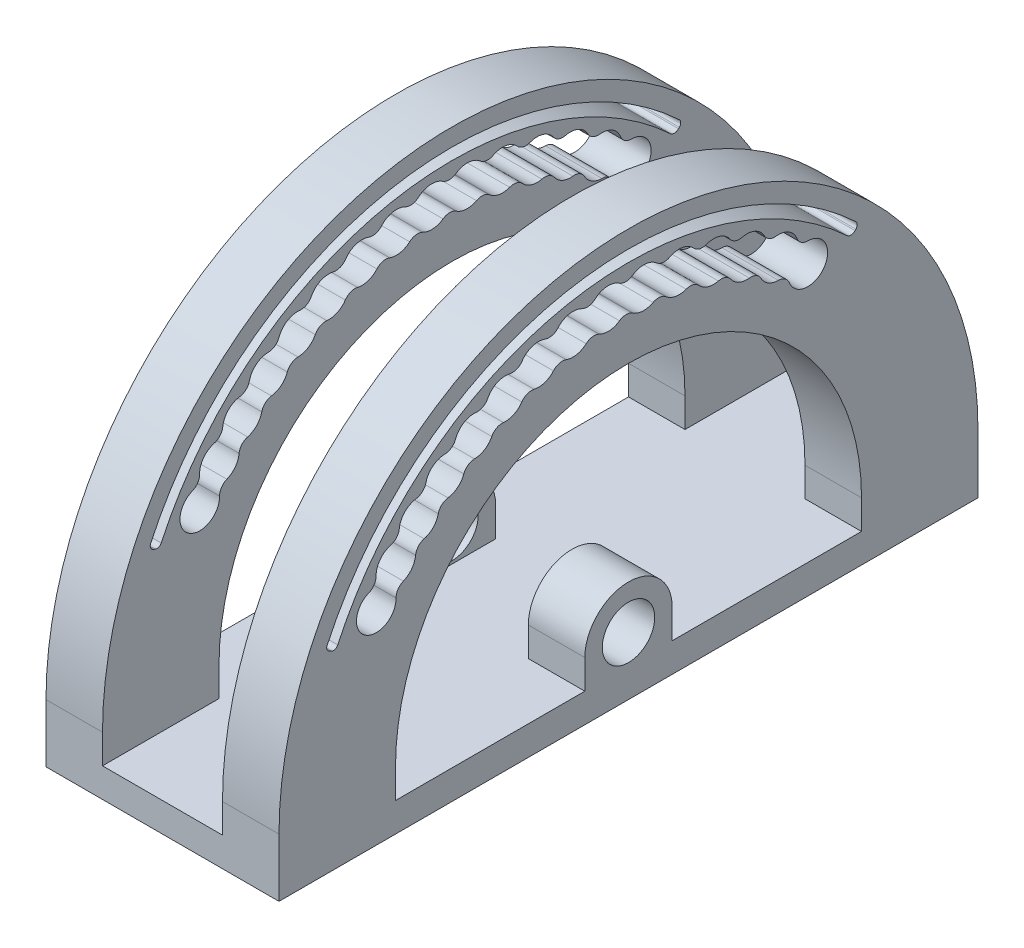
from build123d import *

# Parameters (mm, degrees)
SKETCH_1_W          = 40
SKETCH_1_H          = 120
EXTRUDE_1_DEPTH     = 5
SKETCH_2_R          = 4.5
EXTRUDE_5_DEPTH     = 9.7
EXTRUDE_6_DEPTH     = 9.7
CUT_EXTRUDE_1_DEPTH = 9.7
CUT_EXTRUDE_2_DEPTH = 9.7


with BuildPart() as part:
    # 草图1 → 凸台-拉伸1 (new body)
    with BuildSketch(Plane(origin=(0, 0, 0), x_dir=(1, 0, 0), z_dir=(0, 1, 0))):
        Rectangle(SKETCH_1_W, SKETCH_1_H)
    extrude(amount=EXTRUDE_1_DEPTH)

    # 草图2 → 凸台-拉伸5 (add)
    with BuildSketch(Plane(origin=(20, 0, 0), x_dir=(0, 0, -1), z_dir=(1, 0, 0))):
        with BuildLine():
            Line((-7.5, 5), (7.5, 5))
            Line((7.5, 5), (7.5, 10))
            ThreePointArc((7.5, 10), (0, 17.5), (-7.5, 10))
            Line((-7.5, 10), (-7.5, 5))
        make_face()
        with Locations((0, 10)):
            Circle(SKETCH_2_R, mode=Mode.SUBTRACT)
    extrude_5 = extrude(amount=-EXTRUDE_5_DEPTH)

    # 镜向1: 凸台-拉伸5 across plane
    add(extrude_5.mirror(Plane(origin=(0, 0, 0), x_dir=(0, 0, 1), z_dir=(1, 0, 0))))

    # 草图3 → 凸台-拉伸6 (add)
    with BuildSketch(Plane(origin=(20, 0, 0), x_dir=(0, 0, -1), z_dir=(1, 0, 0))):
        with BuildLine():
            Line((-60, 10), (-60, 5))
            Line((-60, 5), (-40, 5))
            Line((-40, 5), (-40, 10))
            ThreePointArc((-40, 10), (0, 50), (40, 10))
            Line((40, 10), (40, 5))
            Line((40, 5), (60, 5))
            Line((60, 5), (60, 10))
            ThreePointArc((60, 10), (0, 70), (-60, 10))
        make_face()
    extrude_6 = extrude(amount=-EXTRUDE_6_DEPTH)

    # 草图4 → 切除-拉伸1 (cut)
    with BuildSketch(Plane(origin=(20, 0, 0), x_dir=(0, 0, -1), z_dir=(1, 0, 0))):
        with BuildLine():
            ThreePointArc((-44.579297586, 38.150658022), (-45.177855939, 32.164788205), (-39.901709101, 35.054629743))
            ThreePointArc((-39.901709101, 35.054629743), (-39.569738929, 36.190638857), (-38.653748106, 36.940093135))
            ThreePointArc((-38.653748106, 36.940093135), (-37.216414768, 38.044580079), (-36.550896536, 39.730671422))
            ThreePointArc((-36.550896536, 39.730671422), (-36.082956134, 40.817755909), (-35.082457468, 41.449992668))
            ThreePointArc((-35.082457468, 41.449992668), (-33.521234696, 42.371080063), (-32.655194291, 43.963497267))
            ThreePointArc((-32.655194291, 43.963497267), (-32.058259573, 44.985451202), (-30.988168193, 45.491045248))
            ThreePointArc((-30.988168193, 45.491045248), (-29.326330223, 46.215001804), (-28.272678313, 47.690005596))
            ThreePointArc((-28.272678313, 47.690005596), (-27.555648201, 48.631593999), (-26.431916705, 49.00300809))
            ThreePointArc((-26.431916705, 49.00300809), (-24.694237713, 49.519041281), (-23.468681821, 50.854642752))
            ThreePointArc((-23.468681821, 50.854642752), (-22.642245583, 51.701828708), (-21.481626219, 51.933525916))
            ThreePointArc((-21.481626219, 51.933525916), (-19.694010997, 52.233942876), (-18.314821339, 53.410231284))
            ThreePointArc((-18.314821339, 53.410231284), (-17.391299234, 54.150385203), (-16.211094165, 54.238911455))
            ThreePointArc((-16.211094165, 54.238911455), (-14.400191938, 54.319233659), (-12.887929054, 55.318673254))
            ThreePointArc((-12.887929054, 55.318673254), (-11.881088671, 55.940761146), (-10.698892035, 55.88479672))
            ThreePointArc((-10.698892035, 55.88479672), (-8.891699185, 55.743826749), (-7.268907432, 56.551518187))
            ThreePointArc((-7.268907432, 56.551518187), (-6.193758441, 57.046266154), (-5.027194068, 56.84664535))
            ThreePointArc((-5.027194068, 56.84664535), (-3.250651676, 56.486484742), (-1.541523142, 57.090387206))
            ThreePointArc((-1.541523142, 57.090387206), (-0.414093539, 57.450419695), (0.719447784, 57.1101184))
            ThreePointArc((0.719447784, 57.1101184), (2.438855561, 56.53613632), (4.208841707, 56.927247013))
            ThreePointArc((4.208841707, 56.927247013), (5.371744544, 57.147196769), (6.455364326, 56.671288092))
            ThreePointArc((6.455364326, 56.671288092), (8.092005079, 55.89204129), (9.896462421, 56.064529655))
            ThreePointArc((9.896462421, 56.064529655), (11.077502288, 56.141117734), (12.095046255, 55.536696376))
            ThreePointArc((12.095046255, 55.536696376), (13.62452144, 54.563801628), (15.436549674, 54.515096259))
            ThreePointArc((15.436549674, 54.515096259), (16.618119988, 54.447180909), (17.554418903, 53.723257401))
            ThreePointArc((17.554418903, 53.723257401), (18.953927567, 52.571218326), (20.746513526, 52.302045309))
            ThreePointArc((20.746513526, 52.302045309), (21.910999795, 52.090638991), (22.752095597, 51.258005365))
            ThreePointArc((22.752095597, 51.258005365), (24.000774291, 49.943996213), (25.747194647, 49.458368296))
            ThreePointArc((25.747194647, 49.458368296), (26.877237063, 49.106622592), (27.610590951, 48.177691498))
            ThreePointArc((27.610590951, 48.177691498), (33.585102808, 47.474756475), (30.787782865, 52.800534419))
            ThreePointArc((30.787782865, 52.800534419), (29.657740449, 53.152280124), (28.924386561, 54.081211217))
            ThreePointArc((28.924386561, 54.081211217), (27.5030332, 55.772733857), (25.342222373, 56.233592609))
            ThreePointArc((25.342222373, 56.233592609), (24.177736104, 56.444998927), (23.336640302, 57.277632552))
            ThreePointArc((23.336640302, 57.277632552), (21.71973674, 58.783327438), (19.518867716, 58.977414421))
            ThreePointArc((19.518867716, 58.977414421), (18.337297402, 59.045329772), (17.400998487, 59.769253279))
            ThreePointArc((17.400998487, 59.769253279), (15.612649032, 61.066673968), (13.404531699, 60.991095794))
            ThreePointArc((13.404531699, 60.991095794), (12.223491831, 60.914507715), (11.205947864, 61.518929072))
            ThreePointArc((11.205947864, 61.518929072), (9.272812687, 62.588734011), (7.090364988, 62.244617375))
            ThreePointArc((7.090364988, 62.244617375), (5.927462152, 62.024667619), (4.843842369, 62.500576296))
            ThreePointArc((4.843842369, 62.500576296), (2.794740063, 63.326817156), (0.670497267, 62.719292045))
            ThreePointArc((0.670497267, 62.719292045), (-0.456932336, 62.359259556), (-1.590473659, 62.699560851))
            ThreePointArc((-1.590473659, 62.699560851), (-3.724995698, 63.269920284), (-5.759366024, 62.408043498))
            ThreePointArc((-5.759366024, 62.408043498), (-6.834515015, 61.913295531), (-8.001079388, 62.112916335))
            ThreePointArc((-8.001079388, 62.112916335), (-10.189200353, 62.418891596), (-12.103370434, 61.315511733))
            ThreePointArc((-12.103370434, 61.315511733), (-13.110210817, 60.693423841), (-14.292407452, 60.749388268))
            ThreePointArc((-14.292407452, 60.749388268), (-16.5015075, 60.78641797), (-18.266941467, 59.457983883))
            ThreePointArc((-18.266941467, 59.457983883), (-19.190463572, 58.717829963), (-20.370668641, 58.629303711))
            ThreePointArc((-20.370668641, 58.629303711), (-22.567815177, 58.396835828), (-24.158194478, 56.863151408))
            ThreePointArc((-24.158194478, 56.863151408), (-24.984630716, 56.015965451), (-26.145250079, 55.784268244))
            ThreePointArc((-26.145250079, 55.784268244), (-28.29768871, 55.285768335), (-29.689304451, 53.569697285))
            ThreePointArc((-29.689304451, 53.569697285), (-30.406334563, 52.628108882), (-31.530066059, 52.256694791))
            ThreePointArc((-31.530066059, 52.256694791), (-33.605708882, 51.499594342), (-34.777815278, 49.626719329))
            ThreePointArc((-34.777815278, 49.626719329), (-35.374749996, 48.604765394), (-36.444841376, 48.099171347))
            ThreePointArc((-36.444841376, 48.099171347), (-38.412745338, 47.094756983), (-39.347868983, 45.092998259))
            ThreePointArc((-39.347868983, 45.092998259), (-39.815809385, 44.005913772), (-40.816308052, 43.373677013))
            ThreePointArc((-40.816308052, 43.373677013), (-42.647136237, 42.136922236), (-43.33133659, 40.036121414))
            ThreePointArc((-43.33133659, 40.036121414), (-43.663306763, 38.9001123), (-44.579297586, 38.150658022))
        make_face()
    cut_extrude_1 = extrude(amount=-CUT_EXTRUDE_1_DEPTH, mode=Mode.SUBTRACT)

    # 草图5 → 切除-拉伸2 (cut)
    with BuildSketch(Plane(origin=(20, 0, 0), x_dir=(0, 0, -1), z_dir=(1, 0, 0))):
        with BuildLine():
            Line((-50.970597297, 32.693572024), (-51.336052774, 32.856283285))
            ThreePointArc((-51.336052774, 32.856283285), (-51.759549463, 33.305748449), (-51.7367939, 33.922879362))
            ThreePointArc((-51.7367939, 33.922879362), (-10.876112736, 65.952749457), (39.007851649, 51.561851616))
            ThreePointArc((39.007851649, 51.561851616), (39.260131548, 50.998182182), (39.035844869, 50.422800687))
            Line((39.035844869, 50.422800687), (38.894665944, 50.27660563))
            ThreePointArc((38.894665944, 50.27660563), (38.201705422, 49.971611994), (37.493623891, 50.239634286))
            ThreePointArc((37.493623891, 50.239634286), (-10.589518393, 63.970937552), (-49.919111811, 33.088574578))
            ThreePointArc((-49.919111811, 33.088574578), (-50.363874993, 32.67550803), (-50.970597297, 32.693572024))
        make_face()
    cut_extrude_2 = extrude(amount=-CUT_EXTRUDE_2_DEPTH, mode=Mode.SUBTRACT)

    # 镜向2: 凸台-拉伸6, 切除-拉伸1, 切除-拉伸2 across plane
    add(extrude_6.mirror(Plane(origin=(0, 0, 0), x_dir=(0, 0, 1), z_dir=(1, 0, 0))))
    add(cut_extrude_1.mirror(Plane(origin=(0, 0, 0), x_dir=(0, 0, 1), z_dir=(1, 0, 0))), mode=Mode.SUBTRACT)
    add(cut_extrude_2.mirror(Plane(origin=(0, 0, 0), x_dir=(0, 0, 1), z_dir=(1, 0, 0))), mode=Mode.SUBTRACT)


solid = part.part
